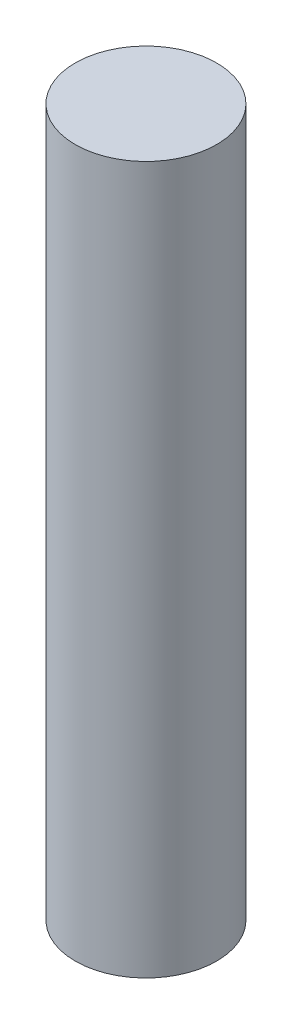
from build123d import *

# Parameters (mm, degrees)
SKETCH_1_R      = 150
EXTRUDE_1_DEPTH = 1500


with BuildPart() as part:
    # 草图1 → 凸台-拉伸1 (new body)
    with BuildSketch(Plane(origin=(0, 0, 0), x_dir=(1, 0, 0), z_dir=(0, 1, 0))):
        with Locations(Location((0, 0, 0), (0, 0, 270))):
            Circle(SKETCH_1_R)
    extrude(amount=EXTRUDE_1_DEPTH)


solid = part.part
